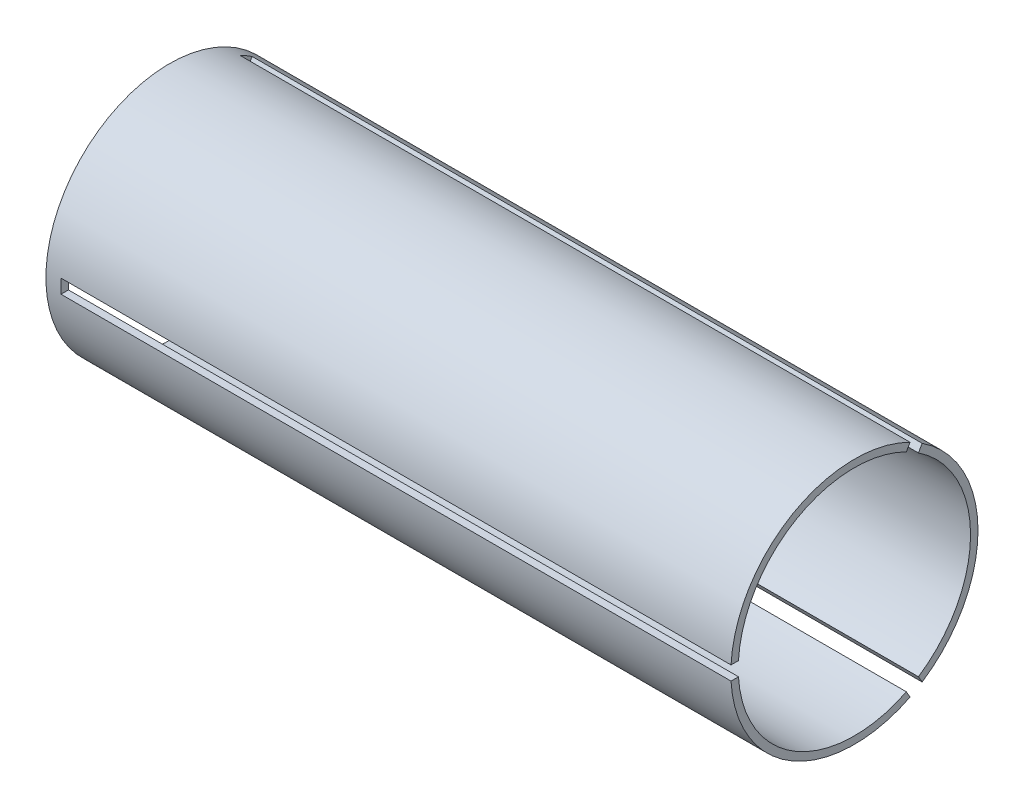
from build123d import *

# Parameters (mm, degrees)
SKETCH1_R           = 42.164
SKETCH1_R_2         = 39.624
BOSS_EXTRUDE1_DEPTH = 233.68
SKETCH2_W           = 4.7625
SKETCH2_H           = 228.6
CUT_EXTRUDE1_DEPTH  = 242.167883832
CIRPATTERN1_COUNT   = 3


with BuildPart() as part:
    # Sketch1 → Boss-Extrude1 (new body)
    with BuildSketch(Plane.YZ):
        with Locations(Location((0, 0, 0), (0, 0, 90))):
            Circle(SKETCH1_R)
        with Locations(Location((0, 0, 0), (0, 0, 90))):
            Circle(SKETCH1_R_2, mode=Mode.SUBTRACT)
    extrude(amount=BOSS_EXTRUDE1_DEPTH)

    # Sketch2 → Cut-Extrude1 (cut, through all)
    with BuildSketch(Plane(origin=(0, 0, 0), x_dir=(0, 1, 0), z_dir=(0, 0, 1))):
        with Locations((0, -119.38)):
            Rectangle(SKETCH2_W, SKETCH2_H)
    cut_extrude1 = extrude(amount=CUT_EXTRUDE1_DEPTH, mode=Mode.SUBTRACT)

    # CirPattern1: Cut-Extrude1 ×3 about axis
    cirpattern1_axis = Axis((0, 0, 0), (1, 0, 0))
    for i in range(1, CIRPATTERN1_COUNT):
        add(cut_extrude1.rotate(cirpattern1_axis, i * 360 / CIRPATTERN1_COUNT), mode=Mode.SUBTRACT)


solid = part.part
